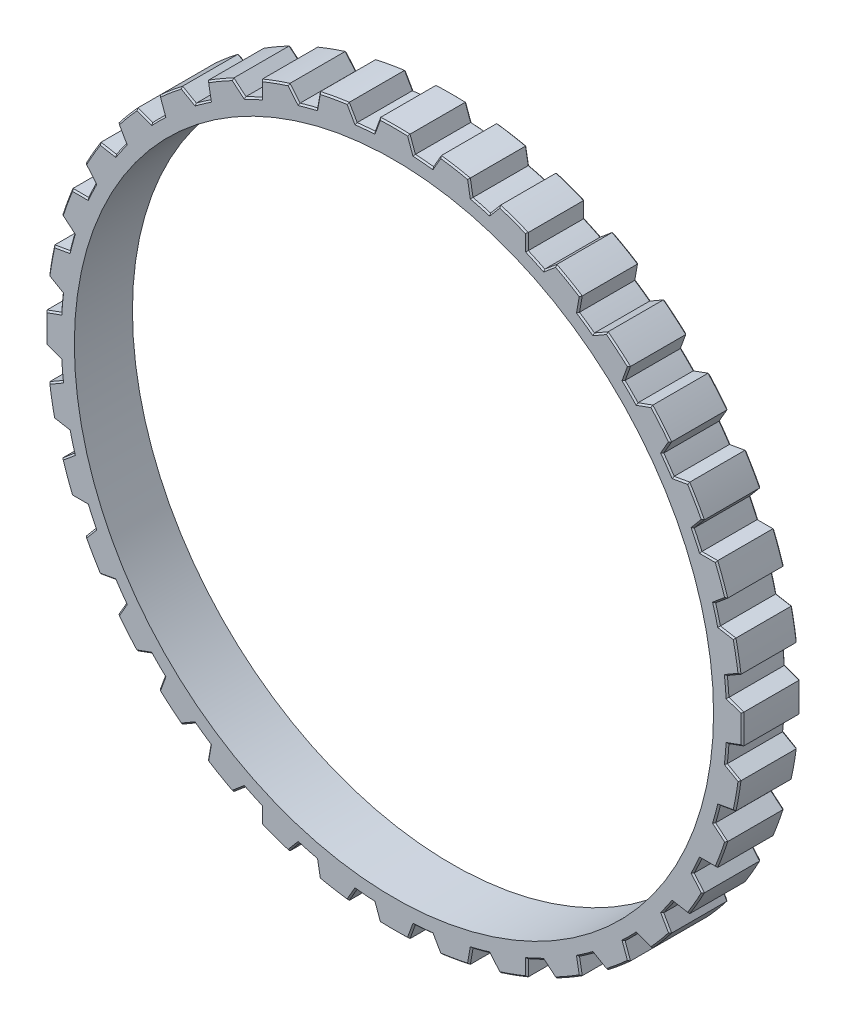
from build123d import *

# Parameters (mm, degrees)
SZKIC1_R                    = 120
SZKIC1_R_2                  = 110
DODANIE_WYCI_GNI_CIE1_DEPTH = 20
WYTNIJ_WYCI_GNI_CIE2_DEPTH  = 171.880074906
SFAZOWANIE1_SIZE            = 0.5


with BuildPart() as part:
    # Szkic1 → Dodanie-wyciągnięcie1 (new body)
    with BuildSketch(Plane.XY):
        Circle(SZKIC1_R)
        Circle(SZKIC1_R_2, mode=Mode.SUBTRACT)
    extrude(amount=DODANIE_WYCI_GNI_CIE1_DEPTH)

    # Szkic2 → Wytnij-wyciągnięcie2 (cut, through all)
    with BuildSketch(Plane(origin=(0, 0, 0), x_dir=(-1, 0, 0), z_dir=(0, 0, -1))):
        with BuildLine():
            ThreePointArc((-114.793104487, 6.89515498), (-114.562390281, 10.022910416), (-114.246470388, 13.143211321))
            Line((-114.246470388, 13.143211321), (-118.947642972, 15.857434578))
            ThreePointArc((-118.947642972, 15.857434578), (-119.543363771, 10.45868913), (-119.894175618, 5.038516925))
            Line((-119.894175618, 5.038516925), (-114.793104487, 6.89515498))
        make_face()
        with BuildLine():
            ThreePointArc((-114.246470388, -13.143211321), (-114.562390281, -10.022910416), (-114.793104487, -6.89515498))
            Line((-114.793104487, -6.89515498), (-119.894175618, -5.038516925))
            ThreePointArc((-119.894175618, -5.038516925), (-119.543363771, -10.45868913), (-118.947642972, -15.857434578))
            Line((-118.947642972, -15.857434578), (-114.246470388, -13.143211321))
        make_face()
        with BuildLine():
            ThreePointArc((-110.228515098, -32.782227796), (-111.081470023, -29.764190187), (-111.851808194, -26.724015485))
            Line((-111.851808194, -26.724015485), (-117.197784408, -25.78137564))
            ThreePointArc((-117.197784408, -25.78137564), (-115.911099155, -31.058285412), (-114.386946385, -36.271565955))
            Line((-114.386946385, -36.271565955), (-110.228515098, -32.782227796))
        make_face()
        with BuildLine():
            ThreePointArc((-102.861322155, -51.425172868), (-104.225395509, -48.6011001), (-105.511951309, -45.740880303))
            Line((-105.511951309, -45.740880303), (-110.940397823, -45.740880303))
            ThreePointArc((-110.940397823, -45.740880303), (-108.756934444, -50.714191409), (-106.350660314, -55.583604155))
            Line((-106.350660314, -55.583604155), (-102.861322155, -51.425172868))
        make_face()
        with BuildLine():
            ThreePointArc((-92.368739989, -68.505590085), (-94.202485093, -65.96129018), (-95.966167175, -63.367931619))
            Line((-95.966167175, -63.367931619), (-101.312143389, -64.310571464))
            ThreePointArc((-101.312143389, -64.310571464), (-98.298245315, -68.829172362), (-95.082963245, -73.206762669))
            Line((-95.082963245, -73.206762669), (-92.368739989, -68.505590085))
        make_face()
        with BuildLine():
            ThreePointArc((-79.069580398, -83.504499613), (-81.317279836, -81.317279836), (-83.504499613, -79.069580398))
            Line((-83.504499613, -79.069580398), (-88.605570744, -80.926218453))
            ThreePointArc((-88.605570744, -80.926218453), (-84.852813742, -84.852813742), (-80.926218453, -88.605570744))
            Line((-80.926218453, -88.605570744), (-79.069580398, -83.504499613))
        make_face()
        with BuildLine():
            ThreePointArc((-63.367931619, -95.966167175), (-65.96129018, -94.202485093), (-68.505590085, -92.368739989))
            Line((-68.505590085, -92.368739989), (-73.206762669, -95.082963245))
            ThreePointArc((-73.206762669, -95.082963245), (-68.829172362, -98.298245315), (-64.310571464, -101.312143389))
            Line((-64.310571464, -101.312143389), (-63.367931619, -95.966167175))
        make_face()
        with BuildLine():
            ThreePointArc((-45.740880303, -105.511951309), (-48.6011001, -104.225395509), (-51.425172868, -102.861322155))
            Line((-51.425172868, -102.861322155), (-55.583604155, -106.350660314))
            ThreePointArc((-55.583604155, -106.350660314), (-50.714191409, -108.756934444), (-45.740880303, -110.940397823))
            Line((-45.740880303, -110.940397823), (-45.740880303, -105.511951309))
        make_face()
        with BuildLine():
            ThreePointArc((-26.724015485, -111.851808194), (-29.764190187, -111.081470023), (-32.782227796, -110.228515098))
            Line((-32.782227796, -110.228515098), (-36.271565955, -114.386946385))
            ThreePointArc((-36.271565955, -114.386946385), (-31.058285412, -115.911099155), (-25.78137564, -117.197784408))
            Line((-25.78137564, -117.197784408), (-26.724015485, -111.851808194))
        make_face()
        with BuildLine():
            ThreePointArc((-6.89515498, -114.793104487), (-10.022910416, -114.562390281), (-13.143211321, -114.246470388))
            Line((-13.143211321, -114.246470388), (-15.857434578, -118.947642972))
            ThreePointArc((-15.857434578, -118.947642972), (-10.45868913, -119.543363771), (-5.038516925, -119.894175618))
            Line((-5.038516925, -119.894175618), (-6.89515498, -114.793104487))
        make_face()
        with BuildLine():
            Line((15.857434578, -118.947642972), (13.143211321, -114.246470388))
            ThreePointArc((13.143211321, -114.246470388), (10.022910416, -114.562390281), (6.89515498, -114.793104487))
            Line((6.89515498, -114.793104487), (5.038516925, -119.894175618))
            ThreePointArc((5.038516925, -119.894175618), (10.45868913, -119.543363771), (15.857434578, -118.947642972))
        make_face()
        with BuildLine():
            Line((36.271565955, -114.386946385), (32.782227796, -110.228515098))
            ThreePointArc((32.782227796, -110.228515098), (29.764190187, -111.081470023), (26.724015485, -111.851808194))
            Line((26.724015485, -111.851808194), (25.78137564, -117.197784408))
            ThreePointArc((25.78137564, -117.197784408), (31.058285412, -115.911099155), (36.271565955, -114.386946385))
        make_face()
        with BuildLine():
            Line((55.583604155, -106.350660314), (51.425172868, -102.861322155))
            ThreePointArc((51.425172868, -102.861322155), (48.6011001, -104.225395509), (45.740880303, -105.511951309))
            Line((45.740880303, -105.511951309), (45.740880303, -110.940397823))
            ThreePointArc((45.740880303, -110.940397823), (50.714191409, -108.756934444), (55.583604155, -106.350660314))
        make_face()
        with BuildLine():
            Line((73.206762669, -95.082963245), (68.505590085, -92.368739989))
            ThreePointArc((68.505590085, -92.368739989), (65.96129018, -94.202485093), (63.367931619, -95.966167175))
            Line((63.367931619, -95.966167175), (64.310571464, -101.312143389))
            ThreePointArc((64.310571464, -101.312143389), (68.829172362, -98.298245315), (73.206762669, -95.082963245))
        make_face()
        with BuildLine():
            Line((88.605570744, -80.926218453), (83.504499613, -79.069580398))
            ThreePointArc((83.504499613, -79.069580398), (81.317279836, -81.317279836), (79.069580398, -83.504499613))
            Line((79.069580398, -83.504499613), (80.926218453, -88.605570744))
            ThreePointArc((80.926218453, -88.605570744), (84.852813742, -84.852813742), (88.605570744, -80.926218453))
        make_face()
        with BuildLine():
            Line((101.312143389, -64.310571464), (95.966167175, -63.367931619))
            ThreePointArc((95.966167175, -63.367931619), (94.202485093, -65.96129018), (92.368739989, -68.505590085))
            Line((92.368739989, -68.505590085), (95.082963245, -73.206762669))
            ThreePointArc((95.082963245, -73.206762669), (98.298245315, -68.829172362), (101.312143389, -64.310571464))
        make_face()
        with BuildLine():
            Line((110.940397823, -45.740880303), (105.511951309, -45.740880303))
            ThreePointArc((105.511951309, -45.740880303), (104.225395509, -48.6011001), (102.861322155, -51.425172868))
            Line((102.861322155, -51.425172868), (106.350660314, -55.583604155))
            ThreePointArc((106.350660314, -55.583604155), (108.756934444, -50.714191409), (110.940397823, -45.740880303))
        make_face()
        with BuildLine():
            Line((117.197784408, -25.78137564), (111.851808194, -26.724015485))
            ThreePointArc((111.851808194, -26.724015485), (111.081470023, -29.764190187), (110.228515098, -32.782227796))
            Line((110.228515098, -32.782227796), (114.386946385, -36.271565955))
            ThreePointArc((114.386946385, -36.271565955), (115.911099155, -31.058285412), (117.197784408, -25.78137564))
        make_face()
        with BuildLine():
            Line((119.894175618, -5.038516925), (114.793104487, -6.89515498))
            ThreePointArc((114.793104487, -6.89515498), (114.562390281, -10.022910416), (114.246470388, -13.143211321))
            Line((114.246470388, -13.143211321), (118.947642972, -15.857434578))
            ThreePointArc((118.947642972, -15.857434578), (119.543363771, -10.45868913), (119.894175618, -5.038516925))
        make_face()
        with BuildLine():
            Line((118.947642972, 15.857434578), (114.246470388, 13.143211321))
            ThreePointArc((114.246470388, 13.143211321), (114.562390281, 10.022910416), (114.793104487, 6.89515498))
            Line((114.793104487, 6.89515498), (119.894175618, 5.038516925))
            ThreePointArc((119.894175618, 5.038516925), (119.543363771, 10.45868913), (118.947642972, 15.857434578))
        make_face()
        with BuildLine():
            Line((114.386946385, 36.271565955), (110.228515098, 32.782227796))
            ThreePointArc((110.228515098, 32.782227796), (111.081470023, 29.764190187), (111.851808194, 26.724015485))
            Line((111.851808194, 26.724015485), (117.197784408, 25.78137564))
            ThreePointArc((117.197784408, 25.78137564), (115.911099155, 31.058285412), (114.386946385, 36.271565955))
        make_face()
        with BuildLine():
            Line((106.350660314, 55.583604155), (102.861322155, 51.425172868))
            ThreePointArc((102.861322155, 51.425172868), (104.225395509, 48.6011001), (105.511951309, 45.740880303))
            Line((105.511951309, 45.740880303), (110.940397823, 45.740880303))
            ThreePointArc((110.940397823, 45.740880303), (108.756934444, 50.714191409), (106.350660314, 55.583604155))
        make_face()
        with BuildLine():
            Line((95.082963245, 73.206762669), (92.368739989, 68.505590085))
            ThreePointArc((92.368739989, 68.505590085), (94.202485093, 65.96129018), (95.966167175, 63.367931619))
            Line((95.966167175, 63.367931619), (101.312143389, 64.310571464))
            ThreePointArc((101.312143389, 64.310571464), (98.298245315, 68.829172362), (95.082963245, 73.206762669))
        make_face()
        with BuildLine():
            ThreePointArc((-13.143211321, 114.246470388), (-10.022910416, 114.562390281), (-6.89515498, 114.793104487))
            Line((-6.89515498, 114.793104487), (-5.038516925, 119.894175618))
            ThreePointArc((-5.038516925, 119.894175618), (-10.45868913, 119.543363771), (-15.857434578, 118.947642972))
            Line((-15.857434578, 118.947642972), (-13.143211321, 114.246470388))
        make_face()
        with BuildLine():
            Line((5.038516925, 119.894175618), (6.89515498, 114.793104487))
            ThreePointArc((6.89515498, 114.793104487), (10.022910416, 114.562390281), (13.143211321, 114.246470388))
            Line((13.143211321, 114.246470388), (15.857434578, 118.947642972))
            ThreePointArc((15.857434578, 118.947642972), (10.45868913, 119.543363771), (5.038516925, 119.894175618))
        make_face()
        with BuildLine():
            Line((25.78137564, 117.197784408), (26.724015485, 111.851808194))
            ThreePointArc((26.724015485, 111.851808194), (29.764190187, 111.081470023), (32.782227796, 110.228515098))
            Line((32.782227796, 110.228515098), (36.271565955, 114.386946385))
            ThreePointArc((36.271565955, 114.386946385), (31.058285412, 115.911099155), (25.78137564, 117.197784408))
        make_face()
        with BuildLine():
            Line((45.740880303, 110.940397823), (45.740880303, 105.511951309))
            ThreePointArc((45.740880303, 105.511951309), (48.6011001, 104.225395509), (51.425172868, 102.861322155))
            Line((51.425172868, 102.861322155), (55.583604155, 106.350660314))
            ThreePointArc((55.583604155, 106.350660314), (50.714191409, 108.756934444), (45.740880303, 110.940397823))
        make_face()
        with BuildLine():
            Line((64.310571464, 101.312143389), (63.367931619, 95.966167175))
            ThreePointArc((63.367931619, 95.966167175), (65.96129018, 94.202485093), (68.505590085, 92.368739989))
            Line((68.505590085, 92.368739989), (73.206762669, 95.082963245))
            ThreePointArc((73.206762669, 95.082963245), (68.829172362, 98.298245315), (64.310571464, 101.312143389))
        make_face()
        with BuildLine():
            Line((80.926218453, 88.605570744), (79.069580398, 83.504499613))
            ThreePointArc((79.069580398, 83.504499613), (81.317279836, 81.317279836), (83.504499613, 79.069580398))
            Line((83.504499613, 79.069580398), (88.605570744, 80.926218453))
            ThreePointArc((88.605570744, 80.926218453), (84.852813742, 84.852813742), (80.926218453, 88.605570744))
        make_face()
        with BuildLine():
            ThreePointArc((-111.851808194, 26.724015485), (-111.081470023, 29.764190187), (-110.228515098, 32.782227796))
            Line((-110.228515098, 32.782227796), (-114.386946385, 36.271565955))
            ThreePointArc((-114.386946385, 36.271565955), (-115.911099155, 31.058285412), (-117.197784408, 25.78137564))
            Line((-117.197784408, 25.78137564), (-111.851808194, 26.724015485))
        make_face()
        with BuildLine():
            ThreePointArc((-105.511951309, 45.740880303), (-104.225395509, 48.6011001), (-102.861322155, 51.425172868))
            Line((-102.861322155, 51.425172868), (-106.350660314, 55.583604155))
            ThreePointArc((-106.350660314, 55.583604155), (-108.756934444, 50.714191409), (-110.940397823, 45.740880303))
            Line((-110.940397823, 45.740880303), (-105.511951309, 45.740880303))
        make_face()
        with BuildLine():
            ThreePointArc((-95.966167175, 63.367931619), (-94.202485093, 65.96129018), (-92.368739989, 68.505590085))
            Line((-92.368739989, 68.505590085), (-95.082963245, 73.206762669))
            ThreePointArc((-95.082963245, 73.206762669), (-98.298245315, 68.829172362), (-101.312143389, 64.310571464))
            Line((-101.312143389, 64.310571464), (-95.966167175, 63.367931619))
        make_face()
        with BuildLine():
            ThreePointArc((-83.504499613, 79.069580398), (-81.317279836, 81.317279836), (-79.069580398, 83.504499613))
            Line((-79.069580398, 83.504499613), (-80.926218453, 88.605570744))
            ThreePointArc((-80.926218453, 88.605570744), (-84.852813742, 84.852813742), (-88.605570744, 80.926218453))
            Line((-88.605570744, 80.926218453), (-83.504499613, 79.069580398))
        make_face()
        with BuildLine():
            ThreePointArc((-68.505590085, 92.368739989), (-65.96129018, 94.202485093), (-63.367931619, 95.966167175))
            Line((-63.367931619, 95.966167175), (-64.310571464, 101.312143389))
            ThreePointArc((-64.310571464, 101.312143389), (-68.829172362, 98.298245315), (-73.206762669, 95.082963245))
            Line((-73.206762669, 95.082963245), (-68.505590085, 92.368739989))
        make_face()
        with BuildLine():
            ThreePointArc((-51.425172868, 102.861322155), (-48.6011001, 104.225395509), (-45.740880303, 105.511951309))
            Line((-45.740880303, 105.511951309), (-45.740880303, 110.940397823))
            ThreePointArc((-45.740880303, 110.940397823), (-50.714191409, 108.756934444), (-55.583604155, 106.350660314))
            Line((-55.583604155, 106.350660314), (-51.425172868, 102.861322155))
        make_face()
        with BuildLine():
            ThreePointArc((-32.782227796, 110.228515098), (-29.764190187, 111.081470023), (-26.724015485, 111.851808194))
            Line((-26.724015485, 111.851808194), (-25.78137564, 117.197784408))
            ThreePointArc((-25.78137564, 117.197784408), (-31.058285412, 115.911099155), (-36.271565955, 114.386946385))
            Line((-36.271565955, 114.386946385), (-32.782227796, 110.228515098))
        make_face()
    extrude(amount=-WYTNIJ_WYCI_GNI_CIE2_DEPTH, mode=Mode.SUBTRACT)

    # Sfazowanie1
    sfazowanie1_edges = [part.edges().sort_by_distance(p)[0] for p in [
        (118.176930361, 20.83778132, 20),
        (112.763114494, 41.042417199, 20),
        (103.923048454, 60, 20),
        (91.925333174, 77.134513162, 20),
        (77.134513162, 91.925333174, 20),
        (60, 103.923048454, 20),
        (41.042417199, 112.763114494, 20),
        (20.83778132, 118.176930361, 20),
        (0, 120, 20),
        (-20.83778132, 118.176930361, 20),
        (-41.042417199, 112.763114494, 20),
        (-60, 103.923048454, 20),
        (-77.134513162, 91.925333174, 20),
        (-91.925333174, 77.134513162, 20),
        (-103.923048454, 60, 20),
        (-112.763114494, 41.042417199, 20),
        (-111.081470023, -29.764190187, 0),
        (-114.524796301, -26.252695563, 20),
        (-112.307730741, -34.526896875, 0),
        (-111.081470023, -29.764190187, 20),
        (-112.307730741, -34.526896875, 20),
        (-118.176930361, 20.83778132, 20),
        (-114.524796301, -26.252695563, 0),
        (-114.562390281, -10.022910416, 0),
        (-117.343640053, -5.966835952, 20),
        (-116.59705668, -14.500322949, 0),
        (-114.562390281, -10.022910416, 20),
        (-116.59705668, -14.500322949, 20),
        (-120, 0, 20),
        (-117.343640053, -5.966835952, 0),
        (-114.562390281, 10.022910416, 0),
        (-116.59705668, 14.500322949, 20),
        (-117.343640053, 5.966835952, 0),
        (-114.562390281, 10.022910416, 20),
        (-118.176930361, -20.83778132, 20),
        (-117.343640053, 5.966835952, 20),
        (-116.59705668, 14.500322949, 0),
        (-111.081470023, 29.764190187, 0),
        (-112.307730741, 34.526896875, 20),
        (-114.524796301, 26.252695563, 0),
        (-112.763114494, -41.042417199, 20),
        (-111.081470023, 29.764190187, 20),
        (-114.524796301, 26.252695563, 20),
        (-112.307730741, 34.526896875, 0),
        (-104.225395509, 48.6011001, 0),
        (-104.605991234, 53.504388511, 20),
        (-108.226174566, 45.740880303, 0),
        (-103.923048454, -60, 20),
        (-104.225395509, 48.6011001, 20),
        (-108.226174566, 45.740880303, 20),
        (-104.605991234, 53.504388511, 0),
        (-94.202485093, 65.96129018, 0),
        (-93.725851617, 70.856176377, 20),
        (-91.925333174, -77.134513162, 20),
        (-98.639155282, 63.839251541, 0),
        (-94.202485093, 65.96129018, 20),
        (-98.639155282, 63.839251541, 20),
        (-93.725851617, 70.856176377, 0),
        (10.022910416, 114.562390281, 0),
        (14.500322949, 116.59705668, 20),
        (-77.134513162, -91.925333174, 20),
        (5.966835952, 117.343640053, 0),
        (10.022910416, 114.562390281, 20),
        (5.966835952, 117.343640053, 20),
        (14.500322949, 116.59705668, 0),
        (-10.022910416, 114.562390281, 0),
        (-5.966835952, 117.343640053, 20),
        (-60, -103.923048454, 20),
        (-14.500322949, 116.59705668, 0),
        (-10.022910416, 114.562390281, 20),
        (-14.500322949, 116.59705668, 20),
        (-5.966835952, 117.343640053, 0),
        (-29.764190187, 111.081470023, 0),
        (-26.252695563, 114.524796301, 20),
        (-41.042417199, -112.763114494, 20),
        (-34.526896875, 112.307730741, 0),
        (-29.764190187, 111.081470023, 20),
        (-34.526896875, 112.307730741, 20),
        (-26.252695563, 114.524796301, 0),
        (-48.6011001, 104.225395509, 0),
        (-45.740880303, 108.226174566, 20),
        (-20.83778132, -118.176930361, 20),
        (-53.504388511, 104.605991234, 0),
        (-48.6011001, 104.225395509, 20),
        (-53.504388511, 104.605991234, 20),
        (-45.740880303, 108.226174566, 0),
        (-65.96129018, 94.202485093, 0),
        (0, -120, 20),
        (-63.839251541, 98.639155282, 20),
        (-70.856176377, 93.725851617, 0),
        (-65.96129018, 94.202485093, 20),
        (-70.856176377, 93.725851617, 20),
        (-63.839251541, 98.639155282, 0),
        (-81.317279836, 81.317279836, 0),
        (20.83778132, -118.176930361, 20),
        (-79.997899426, 86.055035179, 20),
        (-86.055035179, 79.997899426, 0),
        (-81.317279836, 81.317279836, 20),
        (-86.055035179, 79.997899426, 20),
        (-79.997899426, 86.055035179, 0),
        (41.042417199, -112.763114494, 20),
        (111.081470023, 29.764190187, 0),
        (114.524796301, 26.252695563, 20),
        (112.307730741, 34.526896875, 0),
        (111.081470023, 29.764190187, 20),
        (112.307730741, 34.526896875, 20),
        (114.524796301, 26.252695563, 0),
        (60, -103.923048454, 20),
        (104.225395509, 48.6011001, 0),
        (108.226174566, 45.740880303, 20),
        (104.605991234, 53.504388511, 0),
        (104.225395509, 48.6011001, 20),
        (104.605991234, 53.504388511, 20),
        (108.226174566, 45.740880303, 0),
        (77.134513162, -91.925333174, 20),
        (94.202485093, 65.96129018, 0),
        (98.639155282, 63.839251541, 20),
        (93.725851617, 70.856176377, 0),
        (94.202485093, 65.96129018, 20),
        (93.725851617, 70.856176377, 20),
        (98.639155282, 63.839251541, 0),
        (91.925333174, -77.134513162, 20),
        (81.317279836, 81.317279836, 0),
        (86.055035179, 79.997899426, 20),
        (79.997899426, 86.055035179, 0),
        (81.317279836, 81.317279836, 20),
        (79.997899426, 86.055035179, 20),
        (86.055035179, 79.997899426, 0),
        (103.923048454, -60, 20),
        (-104.225395509, -48.6011001, 0),
        (-108.226174566, -45.740880303, 20),
        (-104.605991234, -53.504388511, 0),
        (-104.225395509, -48.6011001, 20),
        (-104.605991234, -53.504388511, 20),
        (-108.226174566, -45.740880303, 0),
        (112.763114494, -41.042417199, 20),
        (-94.202485093, -65.96129018, 0),
        (-98.639155282, -63.839251541, 20),
        (-93.725851617, -70.856176377, 0),
        (-94.202485093, -65.96129018, 20),
        (-93.725851617, -70.856176377, 20),
        (-98.639155282, -63.839251541, 0),
        (118.176930361, -20.83778132, 20),
        (-81.317279836, -81.317279836, 0),
        (-86.055035179, -79.997899426, 20),
        (-79.997899426, -86.055035179, 0),
        (-81.317279836, -81.317279836, 20),
        (-79.997899426, -86.055035179, 20),
        (-86.055035179, -79.997899426, 0),
        (120, 0, 20),
        (-65.96129018, -94.202485093, 0),
        (-70.856176377, -93.725851617, 20),
        (-63.839251541, -98.639155282, 0),
        (-65.96129018, -94.202485093, 20),
        (-63.839251541, -98.639155282, 20),
        (-70.856176377, -93.725851617, 0),
        (118.176930361, 20.83778132, 0),
        (-48.6011001, -104.225395509, 0),
        (-53.504388511, -104.605991234, 20),
        (-45.740880303, -108.226174566, 0),
        (-48.6011001, -104.225395509, 20),
        (-45.740880303, -108.226174566, 20),
        (-53.504388511, -104.605991234, 0),
        (112.763114494, 41.042417199, 0),
        (-29.764190187, -111.081470023, 0),
        (-34.526896875, -112.307730741, 20),
        (-26.252695563, -114.524796301, 0),
        (-29.764190187, -111.081470023, 20),
        (-26.252695563, -114.524796301, 20),
        (-34.526896875, -112.307730741, 0),
        (103.923048454, 60, 0),
        (-10.022910416, -114.562390281, 0),
        (-14.500322949, -116.59705668, 20),
        (-5.966835952, -117.343640053, 0),
        (-10.022910416, -114.562390281, 20),
        (-5.966835952, -117.343640053, 20),
        (-14.500322949, -116.59705668, 0),
        (91.925333174, 77.134513162, 0),
        (10.022910416, -114.562390281, 0),
        (5.966835952, -117.343640053, 20),
        (14.500322949, -116.59705668, 0),
        (10.022910416, -114.562390281, 20),
        (14.500322949, -116.59705668, 20),
        (77.134513162, 91.925333174, 0),
        (5.966835952, -117.343640053, 0),
        (29.764190187, -111.081470023, 0),
        (26.252695563, -114.524796301, 20),
        (34.526896875, -112.307730741, 0),
        (29.764190187, -111.081470023, 20),
        (34.526896875, -112.307730741, 20),
        (60, 103.923048454, 0),
        (26.252695563, -114.524796301, 0),
        (48.6011001, -104.225395509, 0),
        (45.740880303, -108.226174566, 20),
        (53.504388511, -104.605991234, 0),
        (48.6011001, -104.225395509, 20),
        (53.504388511, -104.605991234, 20),
        (41.042417199, 112.763114494, 0),
        (45.740880303, -108.226174566, 0),
        (65.96129018, -94.202485093, 0),
        (63.839251541, -98.639155282, 20),
        (70.856176377, -93.725851617, 0),
        (65.96129018, -94.202485093, 20),
        (70.856176377, -93.725851617, 20),
        (20.83778132, 118.176930361, 0),
        (63.839251541, -98.639155282, 0),
        (81.317279836, -81.317279836, 0),
        (79.997899426, -86.055035179, 20),
        (86.055035179, -79.997899426, 0),
        (81.317279836, -81.317279836, 20),
        (0, 120, 0),
        (86.055035179, -79.997899426, 20),
        (79.997899426, -86.055035179, 0),
        (94.202485093, -65.96129018, 0),
        (93.725851617, -70.856176377, 20),
        (98.639155282, -63.839251541, 0),
        (-20.83778132, 118.176930361, 0),
        (94.202485093, -65.96129018, 20),
        (98.639155282, -63.839251541, 20),
        (93.725851617, -70.856176377, 0),
        (104.225395509, -48.6011001, 0),
        (104.605991234, -53.504388511, 20),
        (108.226174566, -45.740880303, 0),
        (-41.042417199, 112.763114494, 0),
        (104.225395509, -48.6011001, 20),
        (108.226174566, -45.740880303, 20),
        (104.605991234, -53.504388511, 0),
        (111.081470023, -29.764190187, 0),
        (112.307730741, -34.526896875, 20),
        (-60, 103.923048454, 0),
        (114.524796301, -26.252695563, 0),
        (111.081470023, -29.764190187, 20),
        (114.524796301, -26.252695563, 20),
        (112.307730741, -34.526896875, 0),
        (114.562390281, -10.022910416, 0),
        (116.59705668, -14.500322949, 20),
        (-77.134513162, 91.925333174, 0),
        (117.343640053, -5.966835952, 0),
        (114.562390281, -10.022910416, 20),
        (117.343640053, -5.966835952, 20),
        (116.59705668, -14.500322949, 0),
        (65.96129018, 94.202485093, 0),
        (70.856176377, 93.725851617, 20),
        (-91.925333174, 77.134513162, 0),
        (63.839251541, 98.639155282, 0),
        (65.96129018, 94.202485093, 20),
        (63.839251541, 98.639155282, 20),
        (70.856176377, 93.725851617, 0),
        (48.6011001, 104.225395509, 0),
        (53.504388511, 104.605991234, 20),
        (-103.923048454, 60, 0),
        (45.740880303, 108.226174566, 0),
        (48.6011001, 104.225395509, 20),
        (45.740880303, 108.226174566, 20),
        (53.504388511, 104.605991234, 0),
        (29.764190187, 111.081470023, 0),
        (34.526896875, 112.307730741, 20),
        (-112.763114494, 41.042417199, 0),
        (26.252695563, 114.524796301, 0),
        (29.764190187, 111.081470023, 20),
        (26.252695563, 114.524796301, 20),
        (34.526896875, 112.307730741, 0),
        (114.562390281, 10.022910416, 0),
        (-118.176930361, 20.83778132, 0),
        (117.343640053, 5.966835952, 20),
        (116.59705668, 14.500322949, 0),
        (114.562390281, 10.022910416, 20),
        (116.59705668, 14.500322949, 20),
        (117.343640053, 5.966835952, 0),
        (-120, 0, 0),
        (-118.176930361, -20.83778132, 0),
        (-112.763114494, -41.042417199, 0),
        (-103.923048454, -60, 0),
        (-91.925333174, -77.134513162, 0),
        (-77.134513162, -91.925333174, 0),
        (-60, -103.923048454, 0),
        (-41.042417199, -112.763114494, 0),
        (-20.83778132, -118.176930361, 0),
        (0, -120, 0),
        (20.83778132, -118.176930361, 0),
        (41.042417199, -112.763114494, 0),
        (60, -103.923048454, 0),
        (77.134513162, -91.925333174, 0),
        (91.925333174, -77.134513162, 0),
        (103.923048454, -60, 0),
        (112.763114494, -41.042417199, 0),
        (118.176930361, -20.83778132, 0),
        (120, 0, 0),
    ]]
    chamfer(sfazowanie1_edges, length=SFAZOWANIE1_SIZE)


solid = part.part
